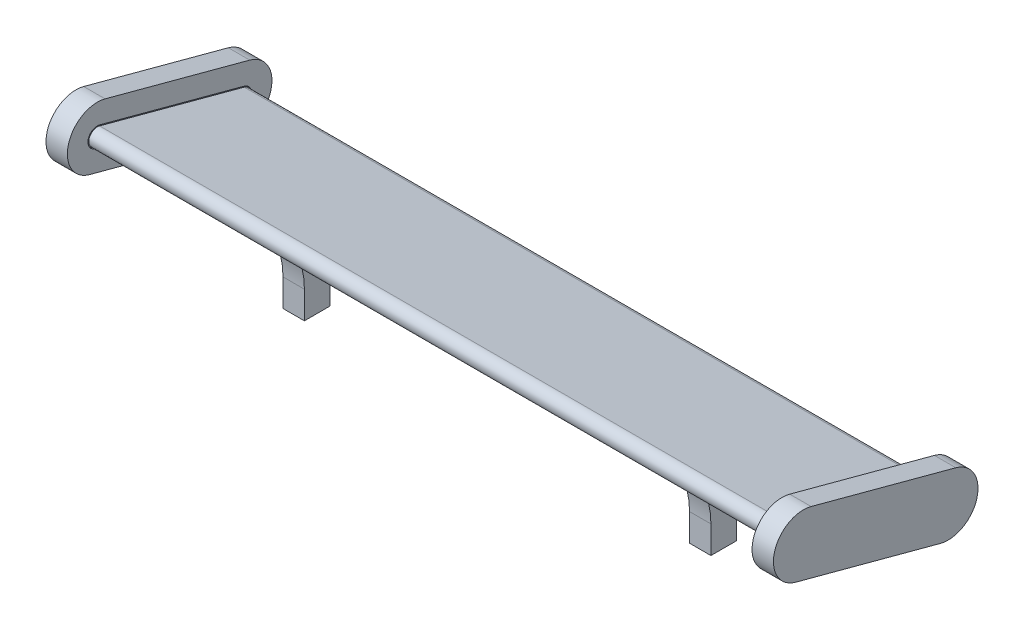
from build123d import *

# Parameters (mm, degrees)
BOSS_EXTRUDE1_DEPTH = 80
BOSS_EXTRUDE2_DEPTH = 5
CUT_EXTRUDE1_DEPTH  = 0.6
BOSS_EXTRUDE5_START = -45
BOSS_EXTRUDE5_DEPTH = 5


with BuildPart() as part:
    # Sketch1 → Boss-Extrude1 (new body)
    with BuildSketch(Plane(origin=(0, 0, 0), x_dir=(0, 0, -1), z_dir=(1, 0, 0))):
        with BuildLine():
            Line((-16.386662876, 6.458949422), (17.420741045, -2.599717156))
            ThreePointArc((17.420741045, -2.599717156), (18.833318093, -5.046372374), (16.386662876, -6.458949422))
            Line((16.386662876, -6.458949422), (-17.420741045, 2.599717156))
            ThreePointArc((-17.420741045, 2.599717156), (-18.833318093, 5.046372374), (-16.386662876, 6.458949422))
        make_face()
    boss_extrude1 = extrude(amount=BOSS_EXTRUDE1_DEPTH)

    # Sketch7 → Boss-Extrude5 (add)
    with BuildSketch(Plane.ZY.offset(BOSS_EXTRUDE5_START)):
        with BuildLine():
            ThreePointArc((-16.386662876, -6.458949422), (-6.804205107, -8.365018782), (-2.482960915, -17.127635169))
            Line((-2.482960915, -17.127635169), (-2.482960915, -21.929616133))
            Line((-2.482960915, -21.929616133), (3.517039085, -21.929616133))
            Line((3.517039085, -21.929616133), (3.517039085, -15.519940014))
            ThreePointArc((3.517039085, -15.519940014), (7.393492667, -4.100276007), (17.420741045, 2.599717156))
            Line((17.420741045, 2.599717156), (-16.386662876, -6.458949422))
        make_face()
        with BuildLine():
            ThreePointArc((-17.420741045, -2.599717156), (-18.833318093, -5.046372374), (-16.386662876, -6.458949422))
            Line((-16.386662876, -6.458949422), (17.420741045, 2.599717156))
            ThreePointArc((17.420741045, 2.599717156), (18.833318093, 5.046372374), (16.386662876, 6.458949422))
            Line((16.386662876, 6.458949422), (-17.420741045, -2.599717156))
        make_face()
    boss_extrude5 = extrude(amount=-BOSS_EXTRUDE5_DEPTH)

    # Mirror1: Boss-Extrude1, Boss-Extrude5 across plane
    add(boss_extrude1.mirror(Plane(origin=(0, 4.529333289, 16.90370196), x_dir=(0, 0, 1), z_dir=(1, 0, 0))))
    add(boss_extrude5.mirror(Plane(origin=(0, 4.529333289, 16.90370196), x_dir=(0, 0, 1), z_dir=(1, 0, 0))))


with BuildPart() as body_2:
    # Sketch2 → Boss-Extrude2 (new body)
    with BuildSketch(Plane(origin=(80, 0, 0), x_dir=(0, 0, -1), z_dir=(1, 0, 0))):
        with BuildLine():
            Line((-18.71483627, -2.229911975), (15.09256765, -11.288578554))
            ThreePointArc((15.09256765, -11.288578554), (23.662947224, -6.340467599), (18.71483627, 2.229911975))
            Line((18.71483627, 2.229911975), (-15.09256765, 11.288578554))
            ThreePointArc((-15.09256765, 11.288578554), (-23.662947224, 6.340467599), (-18.71483627, -2.229911975))
        make_face()
    extrude(amount=BOSS_EXTRUDE2_DEPTH)

    # Sketch8 → Cut-Extrude1 (cut)
    with BuildSketch(Plane.ZY.offset(-80)):
        with BuildLine():
            Line((-17.472504854, -2.406531991), (16.334899067, 6.652134588))
            ThreePointArc((16.334899067, 6.652134588), (19.026503258, 5.098136183), (17.472504854, 2.406531991))
            Line((17.472504854, 2.406531991), (-16.334899067, -6.652134588))
            ThreePointArc((-16.334899067, -6.652134588), (-19.026503258, -5.098136183), (-17.472504854, -2.406531991))
        make_face()
    extrude(amount=-CUT_EXTRUDE1_DEPTH, mode=Mode.SUBTRACT)


with BuildPart() as body_3:
    # Mirror3: mirrored copy
    add(body_2.part.mirror(Plane(origin=(0, 4.529333289, 16.90370196), x_dir=(0, 0, 1), z_dir=(1, 0, 0))))


solid = Compound([part.part, body_2.part, body_3.part])
